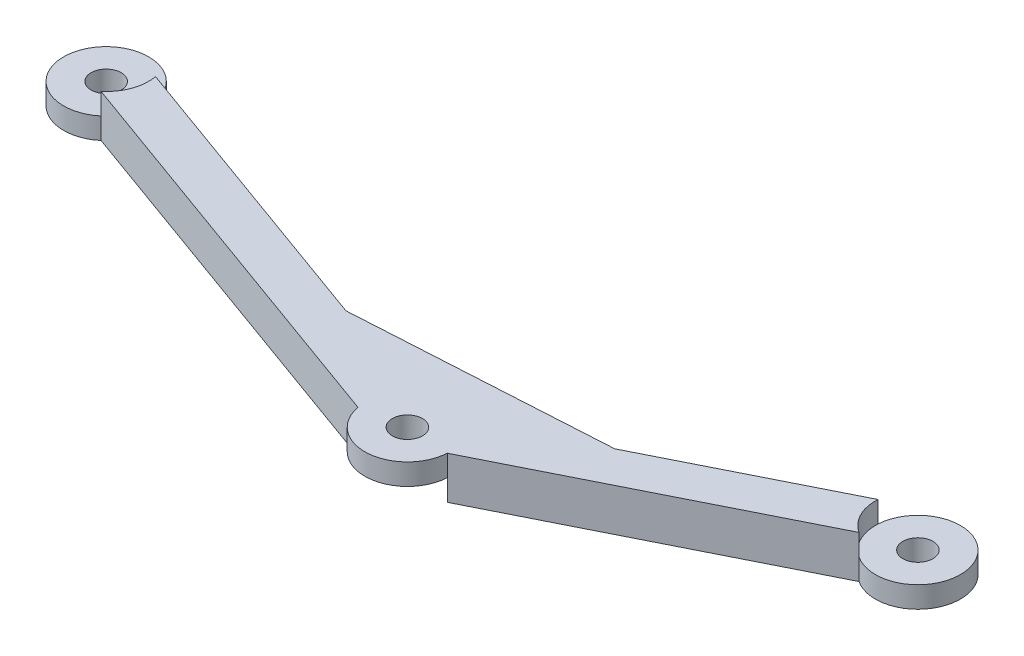
from build123d import *

# Parameters (mm, degrees)
SKETCH2_R           = 2.2479
BOSS_EXTRUDE2_DEPTH = 6.35
CUT_EXTRUDE1_START  = -3.175
SKETCH3_R           = 6.35
CUT_EXTRUDE1_DEPTH  = 3.175
SKETCH4_R           = 6.35
CUT_EXTRUDE2_DEPTH  = 3.175
BOSS_EXTRUDE3_START = -6.35
BOSS_EXTRUDE3_DEPTH = 6.35


with BuildPart() as part:
    # Sketch2 → Boss-Extrude2 (new body)
    with BuildSketch(Plane(origin=(0, 0, 0), x_dir=(1, 0, 0), z_dir=(0, 1, 0))):
        with BuildLine():
            Line((76.696592015, -25.780461907), (117.659214316, -5.299150756))
            ThreePointArc((117.659214316, -5.299150756), (126.837612663, 2.839806331), (114.819407985, 0.380461907))
            Line((114.819407985, 0.380461907), (73.856785684, -20.100849244))
            ThreePointArc((73.856785684, -20.100849244), (69.986110983, -19.060899231), (66.263588885, -20.546310927))
            Line((66.263588885, -20.546310927), (6.250623597, 1.119019502))
            ThreePointArc((6.250623597, 1.119019502), (-5.972708576, 2.156212482), (4.094411115, -4.853689073))
            Line((4.094411115, -4.853689073), (64.107376403, -26.519019502))
            ThreePointArc((64.107376403, -26.519019502), (70.729889017, -31.739100769), (76.696592015, -25.780461907))
        make_face()
        with Locations(Location((70.358, -25.4, 0), (0, 0, 270))):
            Circle(SKETCH2_R, mode=Mode.SUBTRACT)
        with Locations(Location((0, 0, 0), (0, 0, 270))):
            Circle(SKETCH2_R, mode=Mode.SUBTRACT)
        with Locations(Location((121.158, 0, 0), (0, 0, 270))):
            Circle(SKETCH2_R, mode=Mode.SUBTRACT)
    extrude(amount=BOSS_EXTRUDE2_DEPTH)

    # Sketch3 → Cut-Extrude1 (cut)
    with BuildSketch(Plane(origin=(0, 6.35, 0), x_dir=(1, 0, 0), z_dir=(0, 1, 0)).offset(CUT_EXTRUDE1_START)):
        Circle(SKETCH3_R)
        with Locations((121.158, 0)):
            Circle(SKETCH3_R)
    extrude(amount=CUT_EXTRUDE1_DEPTH, mode=Mode.SUBTRACT)

    # Sketch4 → Cut-Extrude2 (cut)
    with BuildSketch(Plane.XZ):
        with Locations((70.358, 25.4)):
            Circle(SKETCH4_R)
    extrude(amount=-CUT_EXTRUDE2_DEPTH, mode=Mode.SUBTRACT)

    # Sketch5 → Boss-Extrude3 (add)
    with BuildSketch(Plane(origin=(0, 6.35, 0), x_dir=(1, 0, 0), z_dir=(0, 1, 0)).offset(BOSS_EXTRUDE3_START)):
        with BuildLine():
            Line((88.623778607, -12.717352782), (73.856785684, -20.100849244))
            ThreePointArc((73.856785684, -20.100849244), (69.986110983, -19.060899231), (66.263588885, -20.546310927))
            Line((66.263588885, -20.546310927), (50.734546588, -14.940158473))
            Line((50.734546588, -14.940158473), (88.623778607, -12.717352782))
        make_face()
    extrude(amount=BOSS_EXTRUDE3_DEPTH)


solid = part.part
